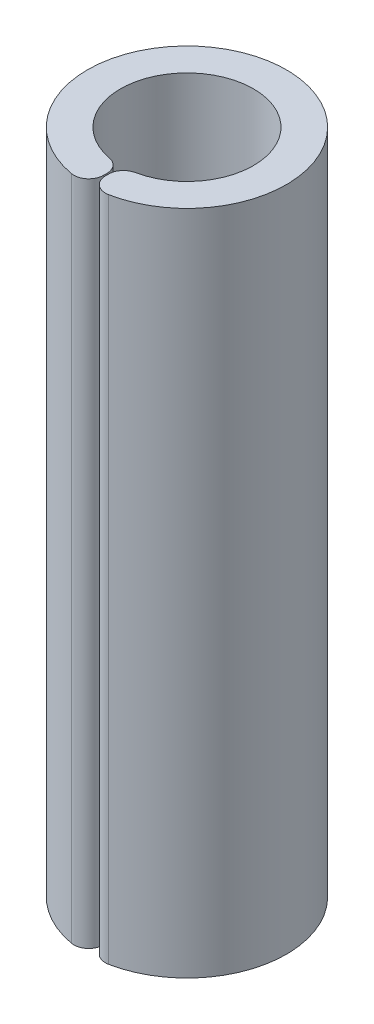
from build123d import *

# Parameters (mm, degrees)
BOSS_EXTRUDE1_DEPTH = 26.8
FILLET1_R           = 0.6


with BuildPart() as part:
    # Sketch1 → Boss-Extrude1 (new body)
    with BuildSketch(Plane(origin=(0, 0, 0), x_dir=(1, 0, 0), z_dir=(0, 1, 0))):
        with BuildLine():
            Line((0.046685187, -2.674592585), (0.069809626, -3.999390781))
            ThreePointArc((0.069809626, -3.999390781), (-0.034906142, 3.999847692), (0, -4))
            Line((0, -4), (0, -2.675))
            ThreePointArc((0, -2.675), (-0.023343482, 2.674898144), (0.046685187, -2.674592585))
        make_face()
    extrude(amount=BOSS_EXTRUDE1_DEPTH)

    # Fillet1
    fillet1_edges = [part.edges().sort_by_distance(p)[0] for p in [
        (0, 13.4, 2.675),
        (0, 13.4, 4),
        (0.069809626, 13.4, 3.999390781),
        (0.046685187, 13.4, 2.674592585),
    ]]
    fillet(fillet1_edges, radius=FILLET1_R)


solid = part.part
